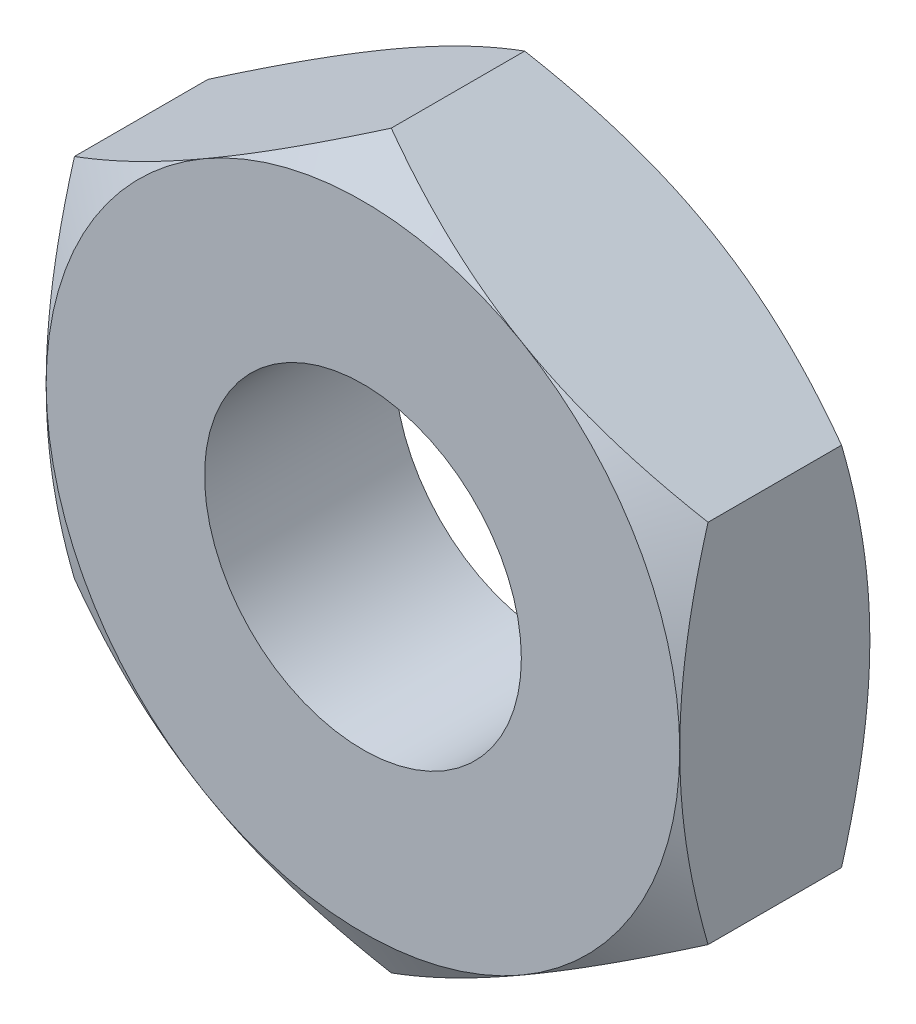
from build123d import *

# Parameters (mm, degrees)
SZKIC1_R                    = 1
DODANIE_WYCI_GNI_CIE1_DEPTH = 0.6
SZKIC2_OUTSIDE_W            = 11.402
SZKIC2_OUTSIDE_H            = 12.02
SZKIC2_OUTSIDE_R            = 2
WYTNIJ_WYCI_GNI_CIE2_DEPTH  = 1.2
WYTNIJ_WYCI_GNI_CIE2_DRAFT  = -60
LUSTRO1_COPY_1_SKETCH_W     = 11.402
LUSTRO1_COPY_1_SKETCH_H     = 12.02
LUSTRO1_COPY_1_SKETCH_R     = 2
LUSTRO1_COPY_1_DEPTH        = 1.2
LUSTRO1_COPY_1_DRAFT        = -60


with BuildPart() as part:
    # Szkic1 → Dodanie-wyciągnięcie1 (new, symmetric)
    with BuildSketch(Plane.XY):
        Polygon((-2, 1.154700538), (-2, -1.154700538), (0, -2.309401077), (2, -1.154700538), (2, 1.154700538), (0, 2.309401077), align=None)
        Circle(SZKIC1_R, mode=Mode.SUBTRACT)
    extrude(amount=DODANIE_WYCI_GNI_CIE1_DEPTH, both=True)


with BuildPart() as wytnij_wyci_gni_cie2_tool:
    # Szkic2 outside → Wytnij-wyciągnięcie2 (with draft: the straight prism first)
    with BuildSketch(Plane.XY.offset(0.6)):
        Rectangle(SZKIC2_OUTSIDE_W, SZKIC2_OUTSIDE_H)
        Circle(SZKIC2_OUTSIDE_R, mode=Mode.SUBTRACT)
    extrude(amount=-WYTNIJ_WYCI_GNI_CIE2_DEPTH)
    # Wytnij-wyciągnięcie2: the draft: its side faces are tilted about the plane it starts from
    wytnij_wyci_gni_cie2_sides = [wytnij_wyci_gni_cie2_tool.faces().sort_by_distance(p)[0] for p in [
        (0, -6.01, 0),
        (5.701, 0, 0),
        (0, 6.01, 0),
        (-5.701, 0, 0),
        (-2, 0, 0),
    ]]
    draft(wytnij_wyci_gni_cie2_sides, Plane.XY.offset(0.6), WYTNIJ_WYCI_GNI_CIE2_DRAFT)


with BuildPart() as part_1:
    add(part.part)

    # Wytnij-wyciągnięcie2: cut by wytnij_wyci_gni_cie2_tool
    add(wytnij_wyci_gni_cie2_tool.part, mode=Mode.SUBTRACT)


with BuildPart() as lustro1_copy_1_tool:
    # Lustro1 copy 1 sketch → Lustro1 copy 1 (with draft: the straight prism first)
    with BuildSketch(Plane(origin=(0, 0, -0.6), x_dir=(1, 0, 0), z_dir=(0, 0, -1))):
        Rectangle(LUSTRO1_COPY_1_SKETCH_W, LUSTRO1_COPY_1_SKETCH_H)
        Circle(LUSTRO1_COPY_1_SKETCH_R, mode=Mode.SUBTRACT)
    extrude(amount=-LUSTRO1_COPY_1_DEPTH)
    # Lustro1 copy 1: the draft: its side faces are tilted about the plane it starts from
    lustro1_copy_1_sides = [lustro1_copy_1_tool.faces().sort_by_distance(p)[0] for p in [
        (0, -6.01, 0),
        (5.701, 0, 0),
        (0, 6.01, 0),
        (-5.701, 0, 0),
        (-2, 0, 0),
    ]]
    draft(lustro1_copy_1_sides, Plane(origin=(0, 0, -0.6), x_dir=(1, 0, 0), z_dir=(0, 0, -1)), LUSTRO1_COPY_1_DRAFT)


with BuildPart() as part_2:
    add(part_1.part)

    # Lustro1 copy 1: cut by lustro1_copy_1_tool
    add(lustro1_copy_1_tool.part, mode=Mode.SUBTRACT)


solid = part_2.part
